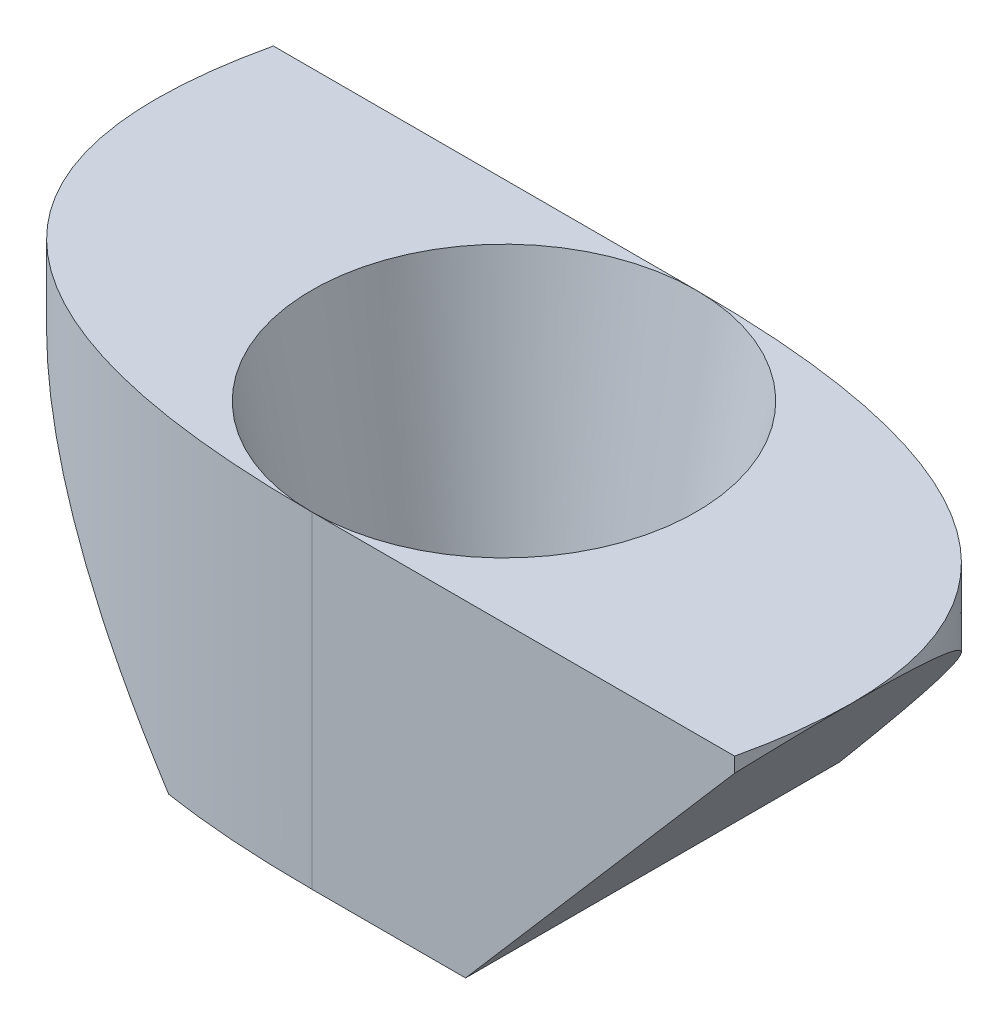
from build123d import *

# Parameters (mm, degrees)
BOSS_EXTRUDE2_DEPTH = 7.62
SKETCH16_W          = 15.32256728
SKETCH16_H          = 7.308103898
CUT_EXTRUDE1_DEPTH  = 2.2225
CUT_EXTRUDE2_REACH  = 19.306
SKETCH18_R          = 3.175
CUT_EXTRUDE3_DEPTH  = 5.3975
CUT_EXTRUDE3_DRAFT  = -10


with BuildPart() as part:
    # Sketch1 → Boss-Extrude2 (new body)
    with BuildSketch(Plane(origin=(0, 0, 0), x_dir=(1, 0, 0), z_dir=(0, 1, 0))):
        with BuildLine():
            Line((6.985, 0), (13.97, 0))
            add(Edge.make_bspline(
                [(6.985, 6.35), (15.415206783, 6.354454923), (13.97, 0)],
                knots=[0, 0, 0, 1, 1, 1], degree=2))
            Line((6.985, 6.35), (0, 6.35))
            add(Edge.make_bspline(
                [(6.985, 0), (-1.445206783, -0.004454923), (0, 6.35)],
                knots=[0, 0, 0, 1, 1, 1], degree=2))
        make_face()
    extrude(amount=BOSS_EXTRUDE2_DEPTH)

    # Sketch16 → Cut-Extrude1 (cut)
    with BuildSketch(Plane.XZ):
        with Locations((6.964918342, -3.123671001)):
            Rectangle(SKETCH16_W, SKETCH16_H)
    extrude(amount=-CUT_EXTRUDE1_DEPTH, mode=Mode.SUBTRACT)

    # Cut-Extrude2: up to this face of the body (flat: up to its plane)
    cut_extrude2_end = Plane(part.part.faces().sort_by_distance((3.4925, 4.92125, -6.35))[0])
    # Sketch17 → Cut-Extrude2 (cut, up to the picked face)
    with BuildSketch(Plane.XY, mode=Mode.PRIVATE) as cut_extrude2_sk1:
        Polygon((9.525, 2.2225), (14.181497233, 7.62), (14.181497233, 2.2225), align=None)
    cut_extrude2_tool1 = split(extrude(cut_extrude2_sk1.sketch, amount=-CUT_EXTRUDE2_REACH, mode=Mode.PRIVATE), bisect_by=cut_extrude2_end, keep=Keep.BOTH, mode=Mode.PRIVATE)
    # Sketch17 → Cut-Extrude2 (cut, up to the picked face)
    with BuildSketch(Plane.XY, mode=Mode.PRIVATE) as cut_extrude2_sk2:
        Polygon((-0.211497233, 2.2225), (4.445, 2.2225), (-0.211497233, 7.62), align=None)
    cut_extrude2_tool2 = split(extrude(cut_extrude2_sk2.sketch, amount=-CUT_EXTRUDE2_REACH, mode=Mode.PRIVATE), bisect_by=cut_extrude2_end, keep=Keep.BOTH, mode=Mode.PRIVATE)
    add(cut_extrude2_tool1.solids().sort_by(Axis((12.629331, 4.021667, 0), (0, 0, -1)))[0], mode=Mode.SUBTRACT)
    add(cut_extrude2_tool2.solids().sort_by(Axis((1.340669, 4.021667, 0), (0, 0, -1)))[0], mode=Mode.SUBTRACT)


with BuildPart() as cut_extrude3_tool:
    # Sketch18 → Cut-Extrude3 (with draft: the straight prism first)
    with BuildSketch(Plane(origin=(0, 7.62, 0), x_dir=(1, 0, 0), z_dir=(0, 1, 0))):
        with Locations((6.985, 3.175)):
            Circle(SKETCH18_R)
    extrude(amount=-CUT_EXTRUDE3_DEPTH)
    # Cut-Extrude3: the draft: its side faces are tilted about the plane it starts from
    cut_extrude3_sides = [cut_extrude3_tool.faces().sort_by_distance(p)[0] for p in [
        (3.81, 4.92125, -3.175),
    ]]
    draft(cut_extrude3_sides, Plane(origin=(0, 7.62, 0), x_dir=(1, 0, 0), z_dir=(0, 1, 0)), CUT_EXTRUDE3_DRAFT)


with BuildPart() as part_1:
    add(part.part)

    # Cut-Extrude3: cut by cut_extrude3_tool
    add(cut_extrude3_tool.part, mode=Mode.SUBTRACT)


solid = part_1.part
